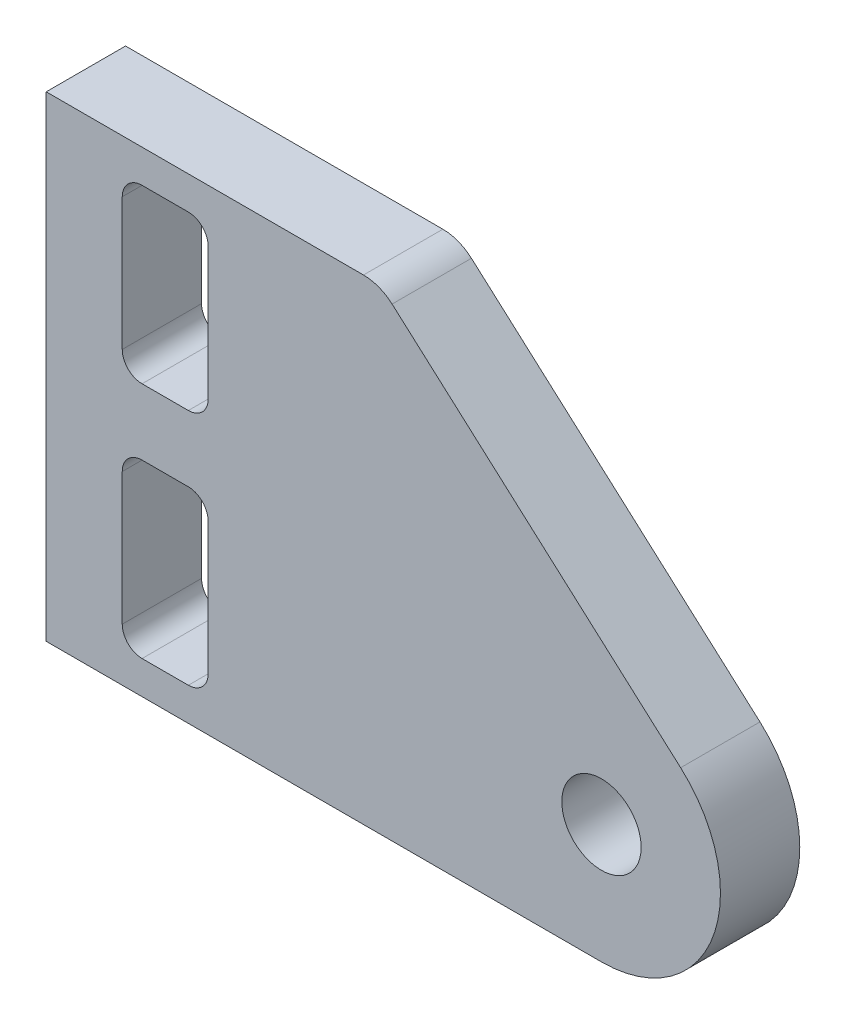
from build123d import *

# Parameters (mm, degrees)
MODEL_R                 = 1.5
SALIENTE_EXTRUIR1_DEPTH = 3


with BuildPart() as part:
    # Model → Saliente-Extruir1 (new body)
    with BuildSketch(Plane.XY):
        with BuildLine():
            Line((201.097853309, 264.646547335), (180.097853309, 264.646547335))
            Line((180.097853309, 264.646547335), (180.097853309, 282.646547335))
            Line((180.097853309, 282.646547335), (192.097853309, 282.646547335))
            ThreePointArc((192.097853309, 282.646547335), (192.676448554, 282.540050724), (193.179205728, 282.234519695))
            Line((193.179205728, 282.234519695), (204.092367701, 272.505547716))
            ThreePointArc((204.092367701, 272.505547716), (205.302939617, 267.544283579), (201.097853309, 264.646547335))
        make_face()
        with Locations((201.097853309, 269.146547335)):
            Circle(MODEL_R, mode=Mode.SUBTRACT)
        with BuildLine():
            Line((183.722853309, 265.896547335), (185.472853309, 265.896547335))
            ThreePointArc((185.472853309, 265.896547335), (186.003183395, 266.116217249), (186.222853309, 266.646547335))
            Line((186.222853309, 266.646547335), (186.222853309, 271.646547335))
            ThreePointArc((186.222853309, 271.646547335), (186.003183395, 272.176877421), (185.472853309, 272.396547335))
            Line((185.472853309, 272.396547335), (183.722853309, 272.396547335))
            ThreePointArc((183.722853309, 272.396547335), (183.192523223, 272.176877421), (182.972853309, 271.646547335))
            Line((182.972853309, 271.646547335), (182.972853309, 266.646547335))
            ThreePointArc((182.972853309, 266.646547335), (183.192523223, 266.116217249), (183.722853309, 265.896547335))
        make_face(mode=Mode.SUBTRACT)
        with BuildLine():
            Line((183.722853309, 274.895968764), (185.472853309, 274.895968764))
            ThreePointArc((185.472853309, 274.895968764), (186.003183395, 275.115638678), (186.222853309, 275.645968764))
            Line((186.222853309, 275.645968764), (186.222853309, 280.645968764))
            ThreePointArc((186.222853309, 280.645968764), (186.003183395, 281.17629885), (185.472853309, 281.395968764))
            Line((185.472853309, 281.395968764), (183.722853309, 281.395968764))
            ThreePointArc((183.722853309, 281.395968764), (183.192523223, 281.17629885), (182.972853309, 280.645968764))
            Line((182.972853309, 280.645968764), (182.972853309, 275.645968764))
            ThreePointArc((182.972853309, 275.645968764), (183.192523223, 275.115638678), (183.722853309, 274.895968764))
        make_face(mode=Mode.SUBTRACT)
    extrude(amount=SALIENTE_EXTRUIR1_DEPTH)


solid = part.part
